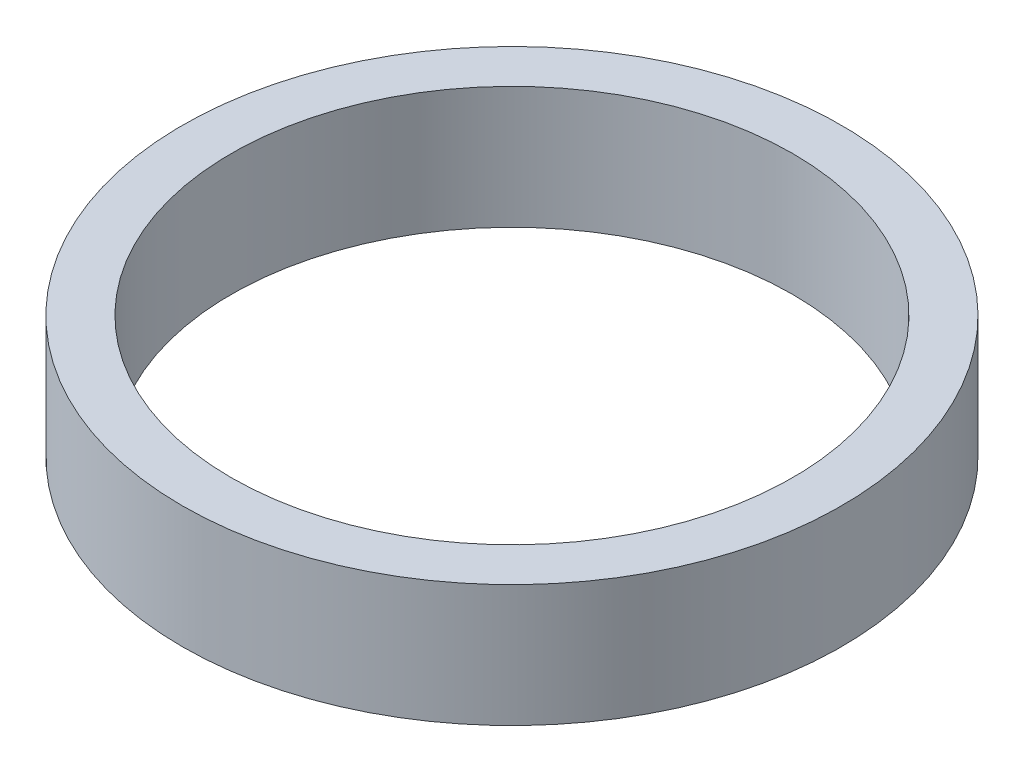
from build123d import *

# Parameters (mm, degrees)
SKETCH1_R           = 13.5
BOSS_EXTRUDE1_DEPTH = 5
SKETCH2_R           = 11.5
CUT_EXTRUDE1_DEPTH  = 20.735754356


with BuildPart() as part:
    # Sketch1 → Boss-Extrude1 (new body)
    with BuildSketch(Plane(origin=(0, 0, 0), x_dir=(1, 0, 0), z_dir=(0, 1, 0))):
        with Locations(Location((0, 0, 0), (0, 0, 270))):
            Circle(SKETCH1_R)
    extrude(amount=BOSS_EXTRUDE1_DEPTH)

    # Sketch2 → Cut-Extrude1 (cut, through all)
    with BuildSketch(Plane(origin=(0, 5, 0), x_dir=(1, 0, 0), z_dir=(0, 1, 0))):
        with Locations(Location((0, 0, 0), (0, 0, 270))):
            Circle(SKETCH2_R)
    extrude(amount=-CUT_EXTRUDE1_DEPTH, mode=Mode.SUBTRACT)


solid = part.part
